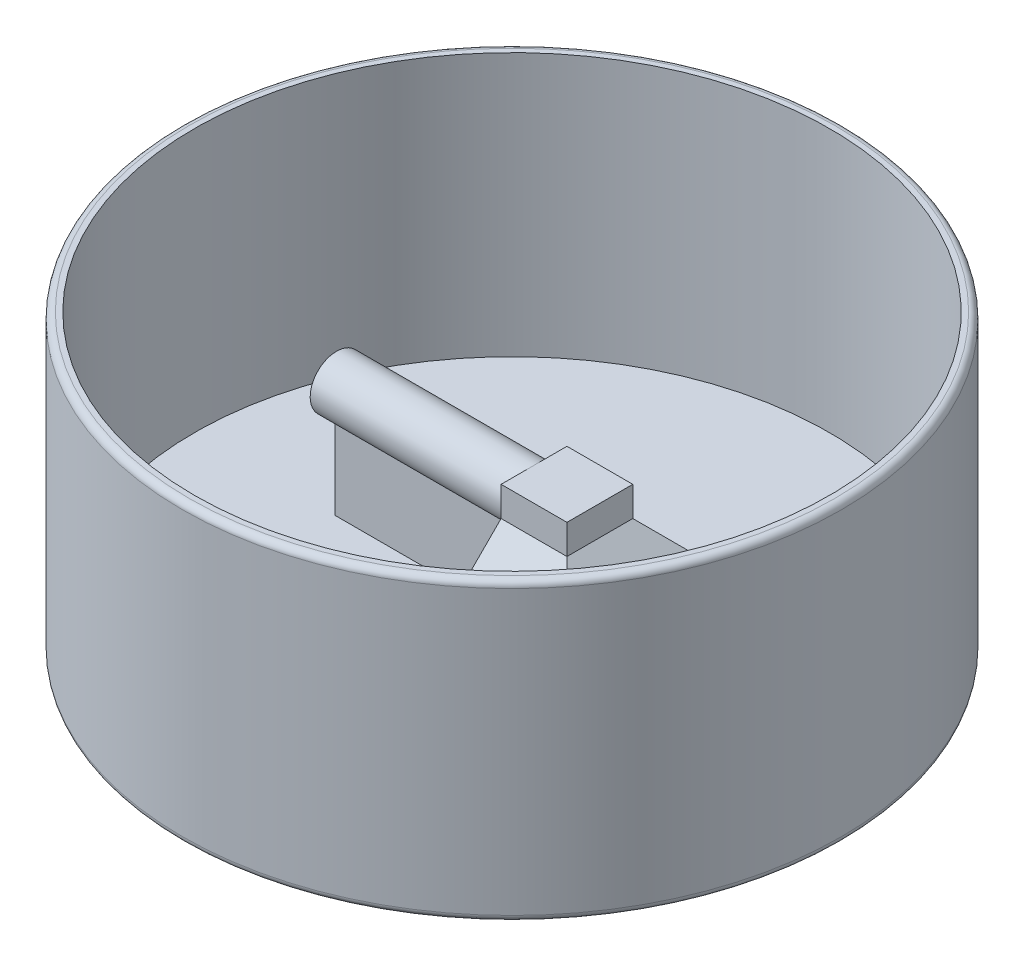
from build123d import *

# Parameters (mm, degrees)
SKETCH1_R                = 50.05
BOSS_EXTRUDE1_DEPTH      = 45
SKETCH3_R                = 48.25
CUT_EXTRUDE2_DEPTH       = 40
SKETCH4_W                = 10
SKETCH4_H                = 10
BOSS_EXTRUDE2_DEPTH      = 21.5
SKETCH5_R                = 4
BOSS_EXTRUDE3_DEPTH      = 30
BOSS_EXTRUDE4_REACH      = 83.302
BOSS_EXTRUDE4_END_RADIUS = 4
SKETCH6_W                = 28.184708005
SKETCH6_H                = 0.2
FILLET1_R                = 1
CHAMFER1_SIZE            = 17
SKETCH7_W                = 4.566458064
SKETCH7_H                = 1.143701811
SKETCH7_W_2              = 4.660128999
SKETCH7_H_2              = 1.247674702
SKETCH7_W_3              = 3.257159631
SKETCH7_H_3              = 1.039728918
SKETCH7_W_4              = 2.28740362
SKETCH7_H_4              = 1.66356627
SKETCH7_W_5              = 2.391376512
SKETCH7_H_5              = 1.975484945
SKETCH7_W_6              = 1.695413964
SKETCH7_H_6              = 1.039728919
SKETCH7_W_7              = 1.401040737
SKETCH7_H_7              = 0.457148196
CUT_EXTRUDE3_DEPTH       = 0.2


with BuildPart() as part:
    # Sketch1 → Boss-Extrude1 (new body)
    with BuildSketch(Plane(origin=(0, 0, 0), x_dir=(1, 0, 0), z_dir=(0, 1, 0))):
        with Locations(Location((0, 0, 0), (0, 0, 90))):
            Circle(SKETCH1_R)
    extrude(amount=BOSS_EXTRUDE1_DEPTH)

    # Sketch3 → Cut-Extrude2 (cut)
    with BuildSketch(Plane(origin=(0, 45, 0), x_dir=(1, 0, 0), z_dir=(0, 1, 0))):
        with Locations(Location((0, 0, 0), (0, 0, 270))):
            Circle(SKETCH3_R)
    extrude(amount=-CUT_EXTRUDE2_DEPTH, mode=Mode.SUBTRACT)

    # Sketch4 → Boss-Extrude2 (add)
    with BuildSketch(Plane(origin=(0, 5, 0), x_dir=(1, 0, 0), z_dir=(0, 1, 0))):
        with Locations((8.34608558, 0)):
            Rectangle(SKETCH4_W, SKETCH4_H)
    extrude(amount=BOSS_EXTRUDE2_DEPTH)

    # Sketch5 → Boss-Extrude3 (add)
    with BuildSketch(Plane.ZY.offset(-3.34608558)):
        with Locations(Location((0, 22.5, 0), (0, 0, 90))):
            Circle(SKETCH5_R)
    extrude(amount=BOSS_EXTRUDE3_DEPTH)

    # Boss-Extrude4: up to this cylinder (the profile starts outside it)
    boss_extrude4_end = Plane(origin=(-12.56156, 22.5, 0), z_dir=(1, 0, 0)) * Cylinder(BOSS_EXTRUDE4_END_RADIUS, 175.604, mode=Mode.PRIVATE)
    # Sketch6 → Boss-Extrude4 (add, up to the surface)
    with BuildSketch(Plane(origin=(0, 5, 0), x_dir=(1, 0, 0), z_dir=(0, 1, 0)), mode=Mode.PRIVATE) as boss_extrude4_sk1:
        with Locations((-12.561560418, -0.1)):
            Rectangle(SKETCH6_W, SKETCH6_H)
    boss_extrude4_tool1 = extrude(boss_extrude4_sk1.sketch, amount=BOSS_EXTRUDE4_REACH, mode=Mode.PRIVATE) - boss_extrude4_end
    add(boss_extrude4_tool1.solids().sort_by_distance((-12.56156, 5, 0.1))[0])

    # Fillet1
    fillet1_edges = [part.edges().sort_by_distance(p)[0] for p in [
        (0, 0, 50.05),
        (0, 45, 50.05),
    ]]
    fillet(fillet1_edges, radius=FILLET1_R)

    # Chamfer1
    chamfer1_edges = [part.edges().sort_by_distance(p)[0] for p in [
        (8.34608558, 5, 5),
        (13.34608558, 5, 0),
        (8.34608558, 5, -5),
    ]]
    chamfer(chamfer1_edges, length=CHAMFER1_SIZE)

    # Sketch7 → Cut-Extrude3 (cut)
    with BuildSketch(Plane.XY):
        with Locations((-20.640838481, 22.591171411)):
            Rectangle(SKETCH7_W, SKETCH7_H)
        with Locations((-10.266782469, 22.539184965)):
            Rectangle(SKETCH7_W_2, SKETCH7_H_2)
        with Locations((-2.115257482, 22.435212073)):
            Rectangle(SKETCH7_W_3, SKETCH7_H_3)
        with Locations((7.901126588, 17.340540373)):
            Rectangle(SKETCH7_W_4, SKETCH7_H_4)
        with Locations((13.775594976, 17.184581036)):
            Rectangle(SKETCH7_W_5, SKETCH7_H_5)
        with Locations((3.589327362, 22.345655797)):
            Rectangle(SKETCH7_W_6, SKETCH7_H_6)
        with Locations((6.850941154, 20.421535498)):
            Rectangle(SKETCH7_W_7, SKETCH7_H_7)
    extrude(amount=-CUT_EXTRUDE3_DEPTH, mode=Mode.SUBTRACT)


solid = part.part
